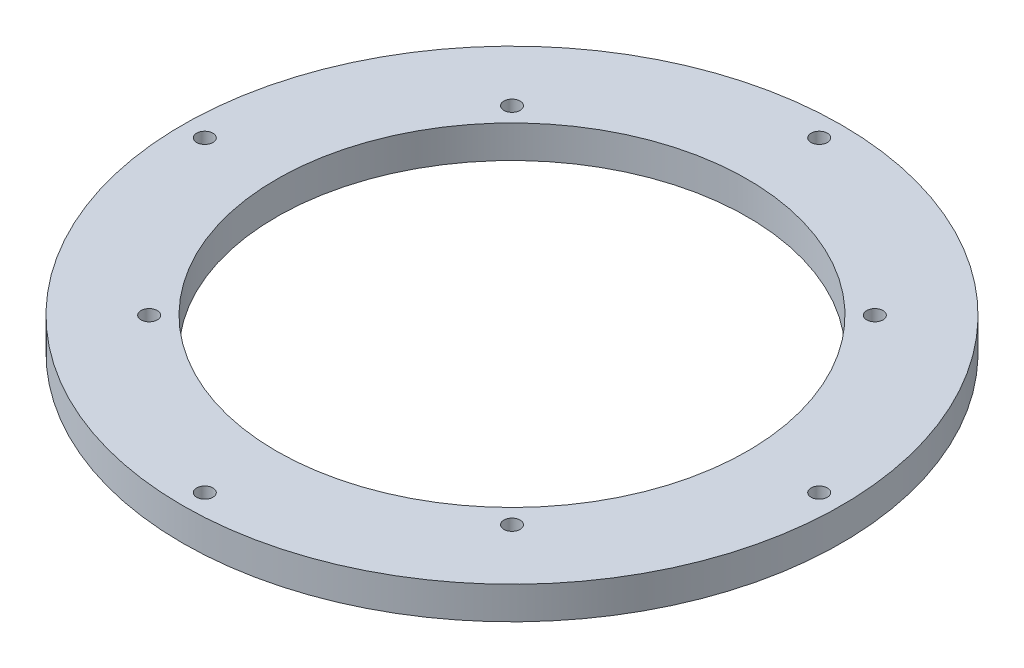
from build123d import *

# Parameters (mm, degrees)
SKETCH_2_R          = 101.25
SKETCH_2_R_2        = 72.35
EXTRUDE_1_DEPTH     = 10
SKETCH_3_R          = 2.5
CUT_EXTRUDE_1_DEPTH = 144.537886985


with BuildPart() as part:
    # 草图2 → 凸台-拉伸1 (new body)
    with BuildSketch(Plane(origin=(0, 0, 0), x_dir=(1, 0, 0), z_dir=(0, 1, 0))):
        with Locations(Location((0, 0, 0), (0, 0, 270))):
            Circle(SKETCH_2_R)
        with Locations(Location((0, 0, 0), (0, 0, 270))):
            Circle(SKETCH_2_R_2, mode=Mode.SUBTRACT)
    extrude(amount=EXTRUDE_1_DEPTH)

    # 草图3 → 切除-拉伸1 (cut, through all)
    with BuildSketch(Plane(origin=(0, 10, 0), x_dir=(1, 0, 0), z_dir=(0, 1, 0))):
        with Locations(Location((0, 94.385, 0), (0, 0, 270))):
            Circle(SKETCH_3_R)
        with Locations(Location((55.741227561, 55.741227561, 0), (0, 0, 270))):
            Circle(SKETCH_3_R)
        with Locations(Location((94.385, 0, 0), (0, 0, 270))):
            Circle(SKETCH_3_R)
        with Locations(Location((0, -94.385, 0), (0, 0, 270))):
            Circle(SKETCH_3_R)
        with Locations(Location((-94.385, 0, 0), (0, 0, 270))):
            Circle(SKETCH_3_R)
        with Locations(Location((55.741227561, -55.741227561, 0), (0, 0, 270))):
            Circle(SKETCH_3_R)
        with Locations(Location((-55.741227561, -55.741227561, 0), (0, 0, 270))):
            Circle(SKETCH_3_R)
        with Locations(Location((-55.741227561, 55.741227561, 0), (0, 0, 270))):
            Circle(SKETCH_3_R)
    extrude(amount=-CUT_EXTRUDE_1_DEPTH, mode=Mode.SUBTRACT)


solid = part.part
